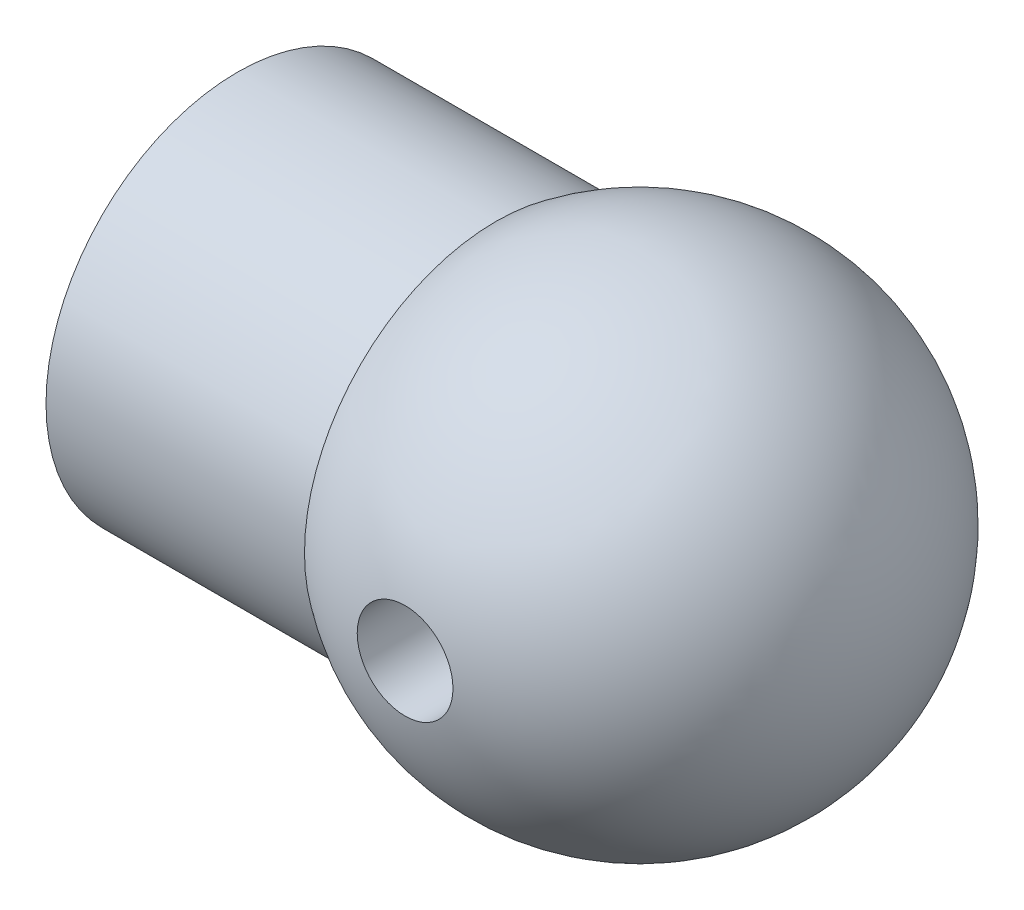
from build123d import *

# Parameters (mm, degrees)
CUT_EXTRUDE_1_DEPTH      = 76.756187866
CUT_EXTRUDE_1_DEPTH_BACK = 76.756187866
SKETCH_3_R               = 5


with BuildPart() as part:
    # 草图1 → 旋转1 (revolve)
    with BuildSketch(Plane.XY):
        with BuildLine():
            Line((0, 0), (0, 20))
            Line((0, 20), (27, 20))
            ThreePointArc((27, 20), (53.180339887, 22.360679775), (67, 0))
            Line((67, 0), (0, 0))
        make_face()
    revolve(axis=Axis((0, 0, 0), (1, 0, 0)))

    # 草图3 → 切除-拉伸1 (cut, two sides: drawn at the far end of the back side and taken through both)
    with BuildSketch(Plane.XY.offset(-CUT_EXTRUDE_1_DEPTH_BACK)):
        with Locations((42, 0)):
            Circle(SKETCH_3_R)
    extrude(amount=CUT_EXTRUDE_1_DEPTH + CUT_EXTRUDE_1_DEPTH_BACK, mode=Mode.SUBTRACT)


solid = part.part
